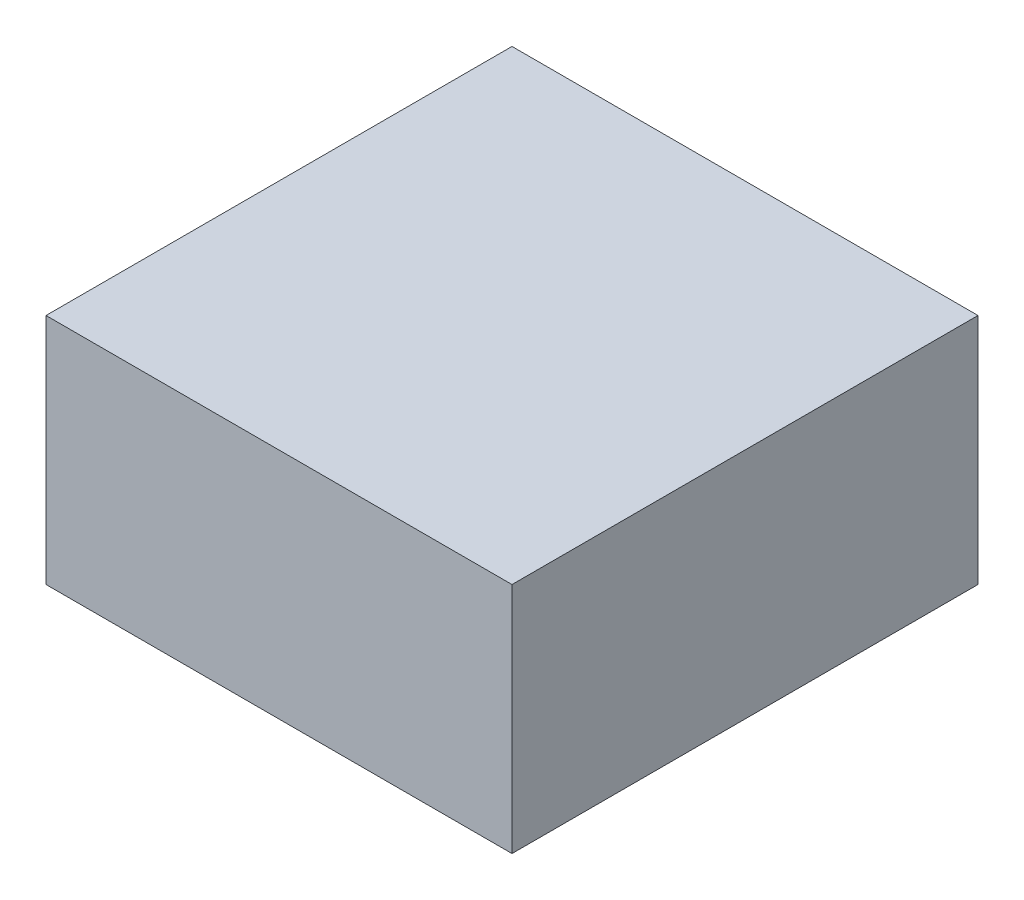
from build123d import *

# Parameters (mm, degrees)
SKETCH1_W           = 10
SKETCH1_H           = 10
BOSS_EXTRUDE1_DEPTH = 5


with BuildPart() as part:
    # Sketch1 → Boss-Extrude1 (new body)
    with BuildSketch(Plane(origin=(0, 0, 0), x_dir=(1, 0, 0), z_dir=(0, 1, 0))):
        Rectangle(SKETCH1_W, SKETCH1_H)
    extrude(amount=BOSS_EXTRUDE1_DEPTH)


solid = part.part
